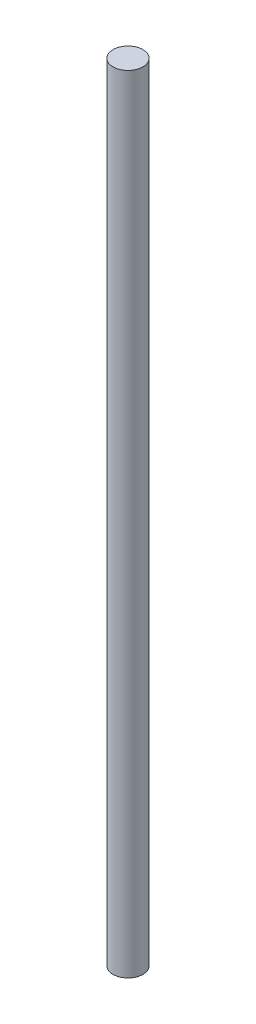
from build123d import *

# Parameters (mm, degrees)
SKETCH1_R           = 4
BOSS_EXTRUDE1_DEPTH = 210


with BuildPart() as part:
    # Sketch1 → Boss-Extrude1 (new body)
    with BuildSketch(Plane(origin=(0, 0, 0), x_dir=(1, 0, 0), z_dir=(0, 1, 0))):
        with Locations(Location((0, 0, 0), (0, 0, 270))):
            Circle(SKETCH1_R)
    extrude(amount=BOSS_EXTRUDE1_DEPTH)


solid = part.part
